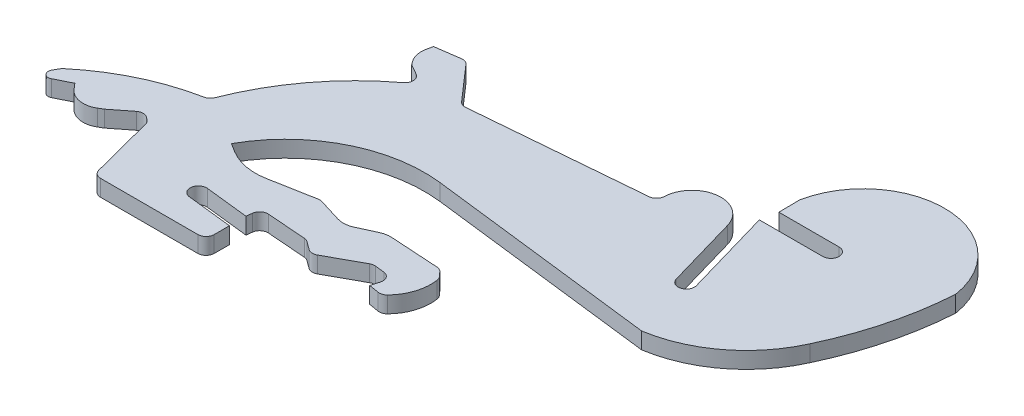
from build123d import *

# Parameters (mm, degrees)
BOSS_EXTRUDE1_DEPTH = 3
FILLET1_R           = 10
FILLET2_R           = 1
FILLET3_R           = 1.5
FILLET4_R           = 4
FILLET5_R           = 4


with BuildPart() as part:
    # Sketch2 → Boss-Extrude1 (new body)
    with BuildSketch(Plane(origin=(0, 0, 0), x_dir=(1, 0, 0), z_dir=(0, 1, 0))):
        with BuildLine():
            Line((-42.5, 9.815250458), (-40.2, 13.848552856))
            ThreePointArc((-40.2, 13.848552856), (-31.616402931, 19.380516515), (-21.88, 22.46))
            ThreePointArc((-21.88, 22.46), (-15.087159026, 34.642704233), (-4.89, 44.16))
            Line((-4.89, 44.16), (-8.851038754, 46.435359195))
            Line((-8.851038754, 46.435359195), (-10.31, 48.433697347))
            Line((-10.31, 48.433697347), (-9.719569356, 51.28656851))
            Line((-9.719569356, 51.28656851), (-4.45, 52.03))
            Line((-4.45, 52.03), (2.1, 44.53))
            Line((2.1, 44.53), (35.22, 47.35))
            ThreePointArc((35.22, 47.35), (39.1087714, 53.552611798), (45.450837647, 49.895682508))
            Line((45.450837647, 49.895682508), (49.271682555, 36.649721013))
            ThreePointArc((49.271682555, 36.649721013), (51.113757972, 35.62), (52.162431436, 37.451352279))
            Line((52.162431436, 37.451352279), (49.298477535, 47.38))
            Line((49.298477535, 47.38), (47.49564271, 53.63))
            Line((47.49564271, 53.63), (59.07164271, 53.63))
            ThreePointArc((59.07164271, 53.63), (60.57164271, 55.13), (59.07164271, 56.63))
            Line((59.07164271, 56.63), (48.07164271, 56.63))
            Line((48.07164271, 56.63), (48.010812194, 60.48))
            ThreePointArc((48.010812194, 60.48), (62.895920888, 72.4), (77.21, 59.8))
            ThreePointArc((77.21, 59.8), (75.464062366, 48.951036242), (71.72, 38.62))
            ThreePointArc((71.72, 38.62), (64.699564013, 29.762620869), (54.32, 25.29))
            Line((54.32, 25.29), (12.44, 30.35))
            ThreePointArc((12.44, 30.35), (-2.155765073, 27.757228529), (-12.82, 17.46))
            Line((-12.82, 17.46), (-7.923093172, 14.42))
            Line((-7.923093172, 14.42), (4.26, 16.67))
            Line((4.26, 16.67), (10.264967392, 14.82186735))
            Line((10.264967392, 14.82186735), (15.68118928, 17.321714129))
            Line((15.68118928, 17.321714129), (26.105067381, 16.67))
            Line((26.105067381, 16.67), (27.5, 15.12))
            ThreePointArc((27.5, 15.12), (27.256062178, 10.796585791), (24.812537217, 7.22158903))
            Line((24.812537217, 7.22158903), (22.269740859, 7.646334739))
            Line((22.269740859, 7.646334739), (23.205269456, 10.857431213))
            Line((23.205269456, 10.857431213), (19.255161489, 11.297641869))
            Line((19.255161489, 11.297641869), (11.827625236, 7.22158903))
            Line((11.827625236, 7.22158903), (9.25, 9.1))
            Line((9.25, 9.1), (0.278765895, 9.8))
            Line((0.278765895, 9.8), (0, 7.298571725))
            Line((0, 7.298571725), (-7.923093172, 8.181542538))
            ThreePointArc((-7.923093172, 8.181542538), (-9.58, 6.856906829), (-8.255364291, 5.2))
            Line((-8.255364291, 5.2), (0, 4.28))
            Line((0, 4.28), (0, 0))
            Line((0, 0), (-20.44, 0))
            Line((-20.44, 0), (-23.89, 13.229016126))
            Line((-23.89, 13.229016126), (-25.72, 14.58))
            Line((-25.72, 14.58), (-29.87882635, 11.312892327))
            Line((-29.87882635, 11.312892327), (-33.582044966, 9.115250458))
            Line((-33.582044966, 9.115250458), (-36.680656461, 12.703691255))
            Line((-36.680656461, 12.703691255), (-42.5, 9.815250458))
        make_face()
    extrude(amount=BOSS_EXTRUDE1_DEPTH)

    # Fillet1
    fillet1_edges = [part.edges().sort_by_distance(p)[0] for p in [
        (-7.923093172, 1.5, -14.42),
    ]]
    fillet(fillet1_edges, radius=FILLET1_R)

    # Fillet2
    fillet2_edges = [part.edges().sort_by_distance(p)[0] for p in [
        (-42.5, 1.5, -9.815250458),
    ]]
    fillet(fillet2_edges, radius=FILLET2_R)

    # Fillet3
    fillet3_edges = [part.edges().sort_by_distance(p)[0] for p in [
        (4.26, 1.5, -16.67),
        (26.105067381, 1.5, -16.67),
        (27.5, 1.5, -15.12),
        (24.812537217, 1.5, -7.22158903),
        (23.205269456, 1.5, -10.857431213),
        (19.255161489, 1.5, -11.297641869),
        (11.827625236, 1.5, -7.22158903),
        (9.25, 1.5, -9.1),
        (0.278765895, 1.5, -9.8),
        (0, 1.5, 0),
        (-20.44, 1.5, 0),
        (-23.89, 1.5, -13.229016126),
        (-25.72, 1.5, -14.58),
        (-21.88, 1.5, -22.46),
        (-4.89, 1.5, -44.16),
        (-4.45, 1.5, -52.03),
        (2.1, 1.5, -44.53),
        (35.22, 1.5, -47.35),
    ]]
    fillet(fillet3_edges, radius=FILLET3_R)

    # Fillet4
    fillet4_edges = [part.edges().sort_by_distance(p)[0] for p in [
        (-33.582044966, 1.5, -9.115250458),
        (-10.31, 1.5, -48.433697347),
    ]]
    fillet(fillet4_edges, radius=FILLET4_R)

    # Fillet5
    fillet5_edges = [part.edges().sort_by_distance(p)[0] for p in [
        (10.264967392, 1.5, -14.82186735),
        (15.68118928, 1.5, -17.321714129),
    ]]
    fillet(fillet5_edges, radius=FILLET5_R)


solid = part.part
